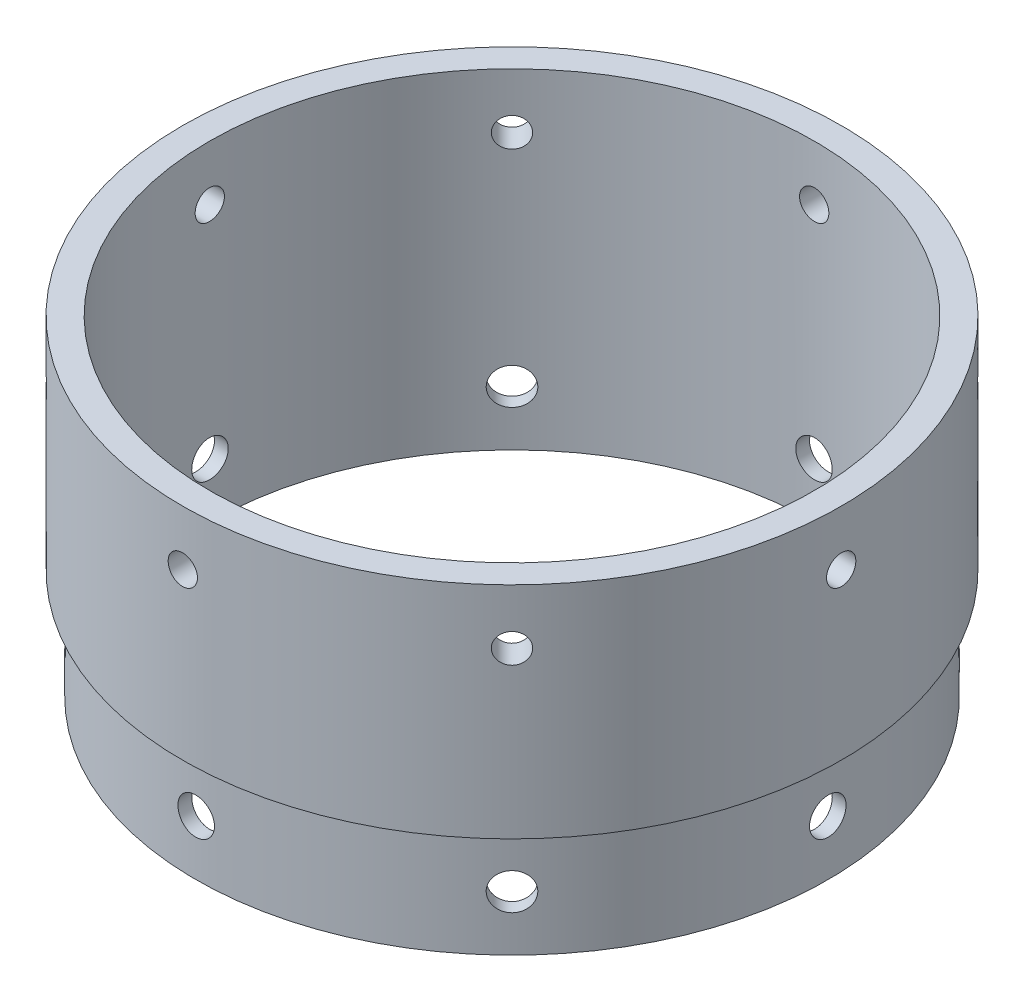
from build123d import *

# Parameters (mm, degrees)
CIRPATTERN1_COUNT = 8


with BuildPart() as part:
    # Sketch1 → Revolve1 (revolve)
    with BuildSketch(Plane.XY, mode=Mode.PRIVATE) as revolve1_sk:
        Polygon((73.025, 0), (73.025, 25.4), (76.073, 25.4), (76.073, 76.2), (69.85, 76.2), (69.85, 0), align=None)
    revolve(revolve1_sk.sketch.rotate(Axis((0, 77.848391372, 0), (0, -1, 0)), 180), axis=Axis((0, 77.848391372, 0), (0, -1, 0)))

    # Sketch4 → 5/16 Clearance Hole1 (revolve, cut)
    with BuildSketch(Plane(origin=(0, 12.7, 76.073), x_dir=(0, -1, 0), z_dir=(1, 0, 0))):
        Polygon((0, 0), (0, 19.304), (4.2164, 16.770531286), (4.2164, 0), align=None)
    f_5_16_clearance_hole1 = revolve(axis=Axis((0, 12.7, 82.423), (0, 0, -1)), mode=Mode.SUBTRACT)

    # Sketch5 → 1/4 Clearance Hole1 (revolve, cut)
    with BuildSketch(Plane(origin=(0, 63.5, 76.073), x_dir=(0, -1, 0), z_dir=(1, 0, 0))):
        Polygon((0, 0), (0, 16.51), (3.3782, 14.480172657), (3.3782, 0), align=None)
    f_1_4_clearance_hole1 = revolve(axis=Axis((0, 63.5, 82.423), (0, 0, -1)), mode=Mode.SUBTRACT)

    # CirPattern1: 5/16 Clearance Hole1, 1/4 Clearance Hole1 ×8 about axis
    cirpattern1_axis = Axis((0, 77.848391372, 0), (0, 1, 0))
    add([f_5_16_clearance_hole1.rotate(cirpattern1_axis, i * 360 / CIRPATTERN1_COUNT) for i in range(1, CIRPATTERN1_COUNT)], mode=Mode.SUBTRACT)
    add([f_1_4_clearance_hole1.rotate(cirpattern1_axis, i * 360 / CIRPATTERN1_COUNT) for i in range(1, CIRPATTERN1_COUNT)], mode=Mode.SUBTRACT)


solid = part.part
